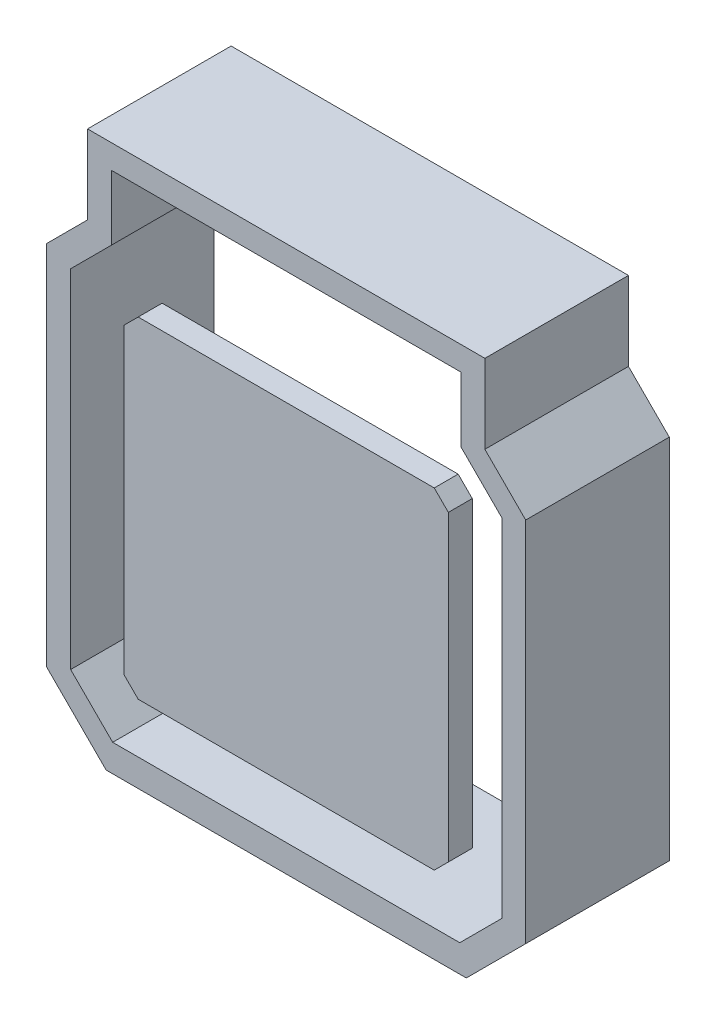
from build123d import *

# Parameters (mm, degrees)
SALIENTE_EXTRUIR1_DEPTH   = 3
SALIENTE_EXTRUIR1_2_DEPTH = 3
SALIENTE_EXTRUIR3_DEPTH   = 15


with BuildPart() as part:
    # Croquis1 → Saliente-Extruir1 (new body)
    with BuildSketch(Plane.XY):
        Polygon((-24.907301525, 28.119315281), (-30.026512204, 23.000104602), (-30.026512204, -23.000104602), (-22.576616806, -30.45), (22.576616806, -30.45), (30.026512204, -23.000104602), (30.026512204, 23.000104602), (24.907301525, 28.119315281), (24.907301525, 38), (-24.907301525, 38), align=None)
        Polygon((-21.907301525, 26.876674594), (-27.026512204, 21.757463915), (-27.026512204, -21.757463915), (-21.757463915, -27.026512204), (21.757463915, -27.026512204), (27.026512204, -21.757463915), (27.026512204, 21.757463915), (21.907301525, 26.876674594), (21.907301525, 35), (-21.907301525, 35), align=None, mode=Mode.SUBTRACT)
    extrude(amount=-SALIENTE_EXTRUIR1_DEPTH)

    # Croquis2 → Saliente-Extruir3 (add)
    with BuildSketch(Plane(origin=(0, 0, -3), x_dir=(-1, 0, 0), z_dir=(0, 0, -1))):
        Polygon((-24.907301525, 28.119315281), (-30.026512204, 23.000104602), (-30.026512204, -23.000104602), (-22.576616806, -30.45), (22.576616806, -30.45), (30.026512204, -23.000104602), (30.026512204, 23.000104602), (24.907301525, 28.119315281), (24.907301525, 38), (-24.907301525, 38), align=None)
        Polygon((27.026512204, -21.757463915), (21.757463915, -27.026512204), (-21.757463915, -27.026512204), (-27.026512204, -21.757463915), (-27.026512204, 21.757463915), (-21.907301525, 26.876674594), (-21.907301525, 35), (21.907301525, 35), (21.907301525, 26.876674594), (27.026512204, 21.757463915), align=None, mode=Mode.SUBTRACT)
    extrude(amount=SALIENTE_EXTRUIR3_DEPTH)


with BuildPart() as body_2:
    # Croquis1 → Saliente-Extruir1 2 (new body)
    with BuildSketch(Plane.XY):
        Polygon((-18.558745251, 20.75), (-20.326512204, 18.982233047), (-20.326512204, -18.982233047), (-18.558745251, -20.75), (18.558745251, -20.75), (20.326512204, -18.982233047), (20.326512204, 18.982233047), (18.558745251, 20.75), align=None)
    extrude(amount=-SALIENTE_EXTRUIR1_2_DEPTH)


solid = Compound([part.part, body_2.part])
